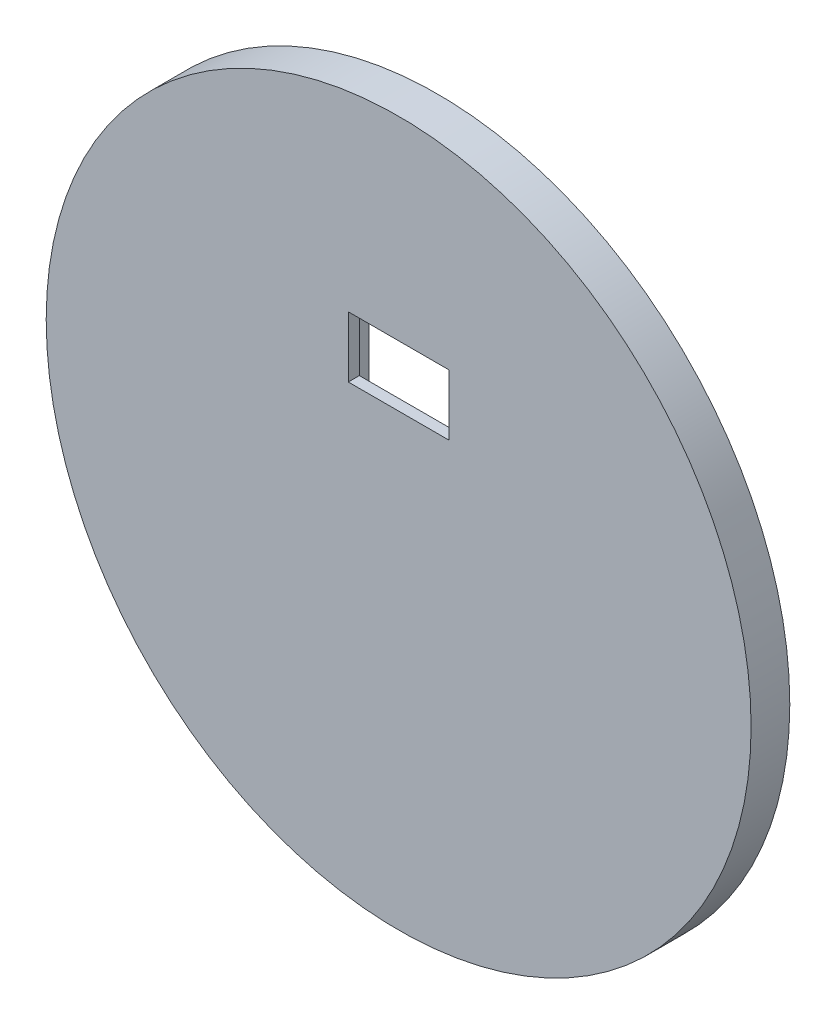
from build123d import *

# Parameters (mm, degrees)
SKETCH1_R           = 63.76
BOSS_EXTRUDE1_DEPTH = 7
SKETCH4_W           = 24.8
SKETCH4_H           = 45.33
CUT_EXTRUDE1_DEPTH  = 5
FILLET1_R           = 6.35
CUT_EXTRUDE2_REACH  = 92.309
SKETCH5_W           = 18.224025504
SKETCH5_H           = 11.004820717


with BuildPart() as part:
    # Sketch1 → Boss-Extrude1 (new body)
    with BuildSketch(Plane.XY):
        Circle(SKETCH1_R)
    extrude(amount=BOSS_EXTRUDE1_DEPTH)

    # Sketch4 → Cut-Extrude1 (cut)
    with BuildSketch(Plane(origin=(0, 0, 0), x_dir=(-1, 0, 0), z_dir=(0, 0, -1))):
        with Locations((0, 10.245)):
            Rectangle(SKETCH4_W, SKETCH4_H)
    extrude(amount=-CUT_EXTRUDE1_DEPTH, mode=Mode.SUBTRACT)

    # Fillet1
    fillet1_edges = [part.edges().sort_by_distance(p)[0] for p in [
        (12.4, -12.42, 2.5),
        (12.4, 32.91, 2.5),
        (-12.4, 32.91, 2.5),
        (-12.4, -12.42, 2.5),
    ]]
    fillet(fillet1_edges, radius=FILLET1_R)

    # Sketch5 → Cut-Extrude2 (cut, up to next)
    with BuildSketch(Plane(origin=(0, 0, 5), x_dir=(-1, 0, 0), z_dir=(0, 0, -1)), mode=Mode.PRIVATE) as cut_extrude2_sk1:
        with Locations((0, 23.06297221)):
            Rectangle(SKETCH5_W, SKETCH5_H)
    cut_extrude2_tool1 = extrude(cut_extrude2_sk1.sketch, amount=-CUT_EXTRUDE2_REACH, mode=Mode.PRIVATE) & part.part
    add(cut_extrude2_tool1.solids().sort_by_distance((0, 23.062972, 5))[0], mode=Mode.SUBTRACT)


solid = part.part
